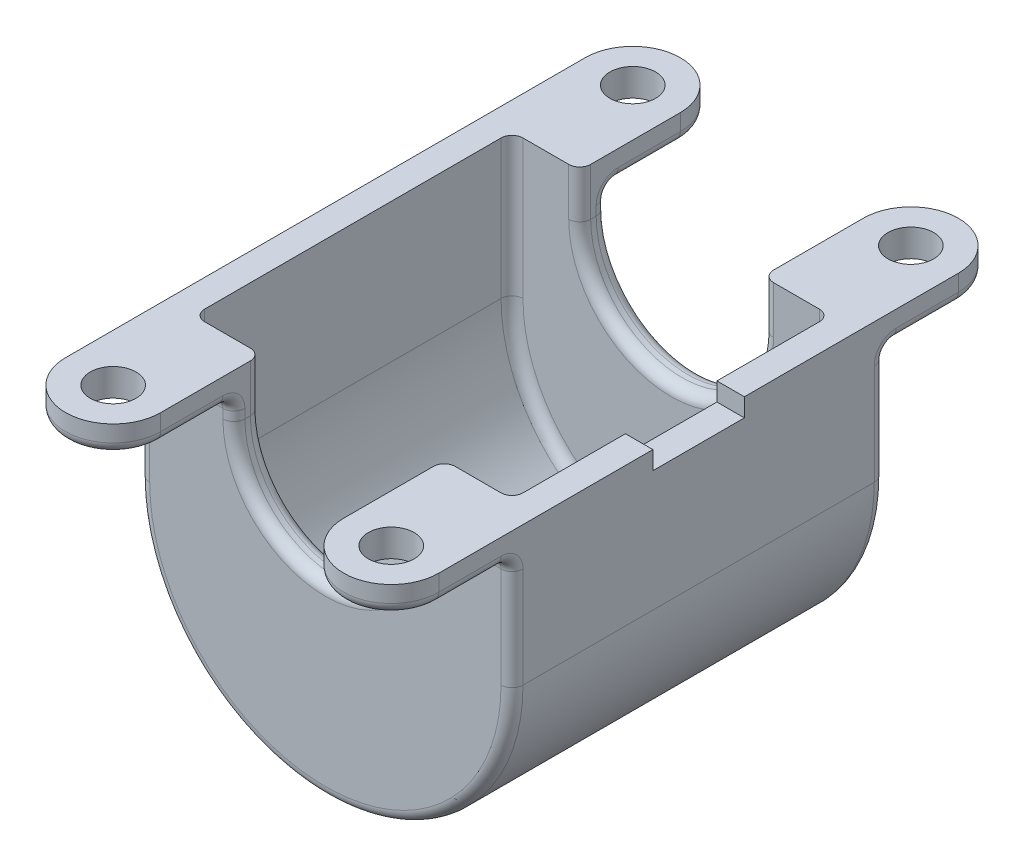
from build123d import *

# Parameters (mm, degrees)
BASE_EXTRUDE_DEPTH      = 51
SHELL1_T                = -7.5
BOSS_EXTRUDE1_DEPTH     = 7.5
SKETCH3_R               = 6.25
CUT_EXTRUDE1_DEPTH      = 133.582050067
MIRROR2_COPY_1_DEPTH    = 7.5
MIRROR2_COPY_2_SKETCH_R = 6.25
MIRROR2_COPY_2_DEPTH    = 133.582050067
CUT_EXTRUDE2_REACH      = 143.637
SKETCH4_W               = 25
SKETCH4_H               = 5
FILLET1_R               = 3
FILLET2_R               = 3


with BuildPart() as part:
    # Sketch1 → Base-Extrude (new, symmetric)
    with BuildSketch(Plane.XY):
        with BuildLine():
            Line((-51, 0), (-51, 38))
            Line((-51, 38), (-25, 38))
            Line((-25, 38), (-25, 25))
            ThreePointArc((-25, 25), (0, 0), (25, 25))
            Line((25, 25), (25, 38))
            Line((25, 38), (51, 38))
            Line((51, 38), (51, 0))
            ThreePointArc((51, 0), (0, -51), (-51, 0))
        make_face()
    extrude(amount=BASE_EXTRUDE_DEPTH, both=True)

    # Shell1
    shell1_openings = [part.faces().sort_by_distance(p)[0] for p in [
        (-38, 38, 0),
        (-25, 31.5, 0),
        (0, 0, 0),
        (25, 31.5, 0),
        (38, 38, 0),
    ]]
    offset(amount=SHELL1_T, openings=shell1_openings, kind=Kind.INTERSECTION)

    # Sketch2 → Boss-Extrude1 (add)
    with BuildSketch(Plane(origin=(0, 38, 0), x_dir=(-1, 0, 0), z_dir=(0, 1, 0))):
        with BuildLine():
            Line((51, 51), (51, 71))
            ThreePointArc((51, 71), (38, 84), (25, 71))
            Line((25, 71), (25, 51))
            Line((25, 51), (51, 51))
        make_face()
    boss_extrude1 = extrude(amount=-BOSS_EXTRUDE1_DEPTH)

    # Sketch3 → Cut-Extrude1 (cut, through all)
    with BuildSketch(Plane(origin=(0, 38, 0), x_dir=(-1, 0, 0), z_dir=(0, 1, 0))):
        with Locations(Location((38, 71, 0), (0, 0, 90))):
            Circle(SKETCH3_R)
    cut_extrude1 = extrude(amount=-CUT_EXTRUDE1_DEPTH, mode=Mode.SUBTRACT)

    # Mirror1: Boss-Extrude1, Cut-Extrude1 across plane
    add(boss_extrude1.mirror(Plane(origin=(0, 0, 0), x_dir=(0, 0, 1), z_dir=(1, 0, 0))))
    add(cut_extrude1.mirror(Plane(origin=(0, 0, 0), x_dir=(0, 0, 1), z_dir=(1, 0, 0))), mode=Mode.SUBTRACT)

    # Mirror2: Boss-Extrude1, Cut-Extrude1 across plane
    add(boss_extrude1.mirror(Plane.XY))
    add(cut_extrude1.mirror(Plane.XY), mode=Mode.SUBTRACT)

    # Mirror2 copy 1 sketch → Mirror2 copy 1 (add)
    with BuildSketch(Plane(origin=(0, 38, 0), x_dir=(1, 0, 0), z_dir=(0, 1, 0))):
        with BuildLine():
            Line((51, 51), (51, 71))
            ThreePointArc((51, 71), (38, 84), (25, 71))
            Line((25, 71), (25, 51))
            Line((25, 51), (51, 51))
        make_face()
    extrude(amount=-MIRROR2_COPY_1_DEPTH)

    # Mirror2 copy 2 sketch → Mirror2 copy 2 (cut, through all)
    with BuildSketch(Plane(origin=(0, 38, 0), x_dir=(1, 0, 0), z_dir=(0, 1, 0))):
        with Locations(Location((38, 71, 0), (0, 0, 90))):
            Circle(MIRROR2_COPY_2_SKETCH_R)
    extrude(amount=-MIRROR2_COPY_2_DEPTH, mode=Mode.SUBTRACT)

    # Sketch4 → Cut-Extrude2 (cut, up to next)
    with BuildSketch(Plane(origin=(51, 0, 0), x_dir=(0, 0, -1), z_dir=(1, 0, 0)), mode=Mode.PRIVATE) as cut_extrude2_sk1:
        with Locations((0, 35.5)):
            Rectangle(SKETCH4_W, SKETCH4_H)
    cut_extrude2_tool1 = extrude(cut_extrude2_sk1.sketch, amount=-CUT_EXTRUDE2_REACH, mode=Mode.PRIVATE) & part.part
    add(cut_extrude2_tool1.solids().sort_by_distance((51, 35.5, 0))[0], mode=Mode.SUBTRACT)

    # Fillet1
    fillet1_edges = [part.edges().sort_by_distance(p)[0] for p in [
        (-38, 30.5, -51),
        (-38, 30.5, 51),
        (38, 30.5, 51),
        (38, 30.5, -51),
    ]]
    fillet(fillet1_edges, radius=FILLET1_R)

    # Fillet2
    fillet2_edges = [part.edges().sort_by_distance(p)[0] for p in [
        (51, 13.75, -51),
        (-38, 30.5, -84),
        (-25, 30.5, -62.5),
        (0, -51, -51),
        (-51, 30.5, -62.5),
        (25, 26.25, -51),
        (-51, 13.75, -51),
        (51, 30.5, -62.5),
        (51, 30.5, 62.5),
        (25, 26.25, 51),
        (-51, 13.75, 51),
        (-51, 30.5, 62.5),
        (-51, 29.621320344, -51.878679656),
        (-25, 29.621320344, -51.878679656),
        (51, 29.621320344, -51.878679656),
        (25, 29.621320344, -51.878679656),
        (51, 29.621320344, 51.878679656),
        (25, 29.621320344, 51.878679656),
        (-51, 29.621320344, 51.878679656),
        (-25, 29.621320344, 51.878679656),
        (0, 0, 51),
        (-25, 26.25, 51),
        (0, -43.5, -43.5),
        (43.5, 19, -43.5),
        (25, 31.5, -43.5),
        (0, 0, -43.5),
        (-25, 31.5, -43.5),
        (-43.5, 19, -43.5),
        (0, -43.5, 43.5),
        (43.5, 19, 43.5),
        (25, 31.5, 43.5),
        (0, 0, 43.5),
        (-25, 31.5, 43.5),
        (-43.5, 19, 43.5),
        (0, -51, 51),
        (-25, 30.5, 62.5),
        (-38, 30.5, 84),
        (38, 30.5, 84),
        (25, 30.5, 62.5),
        (51, 13.75, 51),
        (25, 30.5, -62.5),
        (38, 30.5, -84),
        (-25, 26.25, -51),
        (0, 0, -51),
    ]]
    fillet(fillet2_edges, radius=FILLET2_R)


solid = part.part
